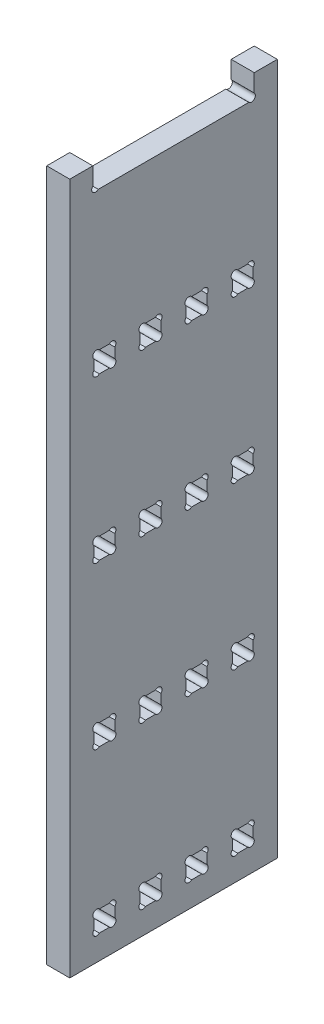
from build123d import *

# Parameters (mm, degrees)
BOSS_EXTRUDE1_DEPTH = 19.05


with BuildPart() as part:
    # Sketch8 → Boss-Extrude1 (new body)
    with BuildSketch(Plane(origin=(0, 0, 0), x_dir=(0, 0, -1), z_dir=(1, 0, 0))):
        with BuildLine():
            Line((-171.45, -571.5), (0, -571.5))
            Line((0, -571.5), (0, 0))
            Line((0, 0), (-19.05, 0))
            Line((-19.05, 0), (-19.05, -14.559871939))
            ThreePointArc((-19.05, -14.559871939), (-19.05, -19.05), (-23.540128061, -19.05))
            Line((-23.540128061, -19.05), (-147.909871939, -19.05))
            ThreePointArc((-147.909871939, -19.05), (-152.4, -19.05), (-152.4, -14.559871939))
            Line((-152.4, -14.559871939), (-152.4, 0))
            Line((-152.4, 0), (-171.45, 0))
            Line((-171.45, 0), (-171.45, -571.5))
        make_face()
        with BuildLine():
            ThreePointArc((-147.020871939, -551.561), (-149.26593597, -552.49093597), (-151.511, -551.561))
            ThreePointArc((-151.511, -551.561), (-152.44093597, -549.31593597), (-151.511, -547.070871939))
            Line((-151.511, -547.070871939), (-151.511, -538.779128061))
            ThreePointArc((-151.511, -538.779128061), (-152.44093597, -536.53406403), (-151.511, -534.289))
            ThreePointArc((-151.511, -534.289), (-149.26593597, -533.35906403), (-147.020871939, -534.289))
            Line((-147.020871939, -534.289), (-138.729128061, -534.289))
            ThreePointArc((-138.729128061, -534.289), (-136.48406403, -533.35906403), (-134.239, -534.289))
            ThreePointArc((-134.239, -534.289), (-133.30906403, -536.53406403), (-134.239, -538.779128061))
            Line((-134.239, -538.779128061), (-134.239, -547.070871939))
            ThreePointArc((-134.239, -547.070871939), (-133.30906403, -549.31593597), (-134.239, -551.561))
            ThreePointArc((-134.239, -551.561), (-136.48406403, -552.49093597), (-138.729128061, -551.561))
            Line((-138.729128061, -551.561), (-147.020871939, -551.561))
        make_face(mode=Mode.SUBTRACT)
        with BuildLine():
            ThreePointArc((-108.920871939, -551.561), (-111.16593597, -552.49093597), (-113.411, -551.561))
            ThreePointArc((-113.411, -551.561), (-114.34093597, -549.31593597), (-113.411, -547.070871939))
            Line((-113.411, -547.070871939), (-113.411, -538.779128061))
            ThreePointArc((-113.411, -538.779128061), (-114.34093597, -536.53406403), (-113.411, -534.289))
            ThreePointArc((-113.411, -534.289), (-111.16593597, -533.35906403), (-108.920871939, -534.289))
            Line((-108.920871939, -534.289), (-100.629128061, -534.289))
            ThreePointArc((-100.629128061, -534.289), (-98.38406403, -533.35906403), (-96.139, -534.289))
            ThreePointArc((-96.139, -534.289), (-95.20906403, -536.53406403), (-96.139, -538.779128061))
            Line((-96.139, -538.779128061), (-96.139, -547.070871939))
            ThreePointArc((-96.139, -547.070871939), (-95.20906403, -549.31593597), (-96.139, -551.561))
            ThreePointArc((-96.139, -551.561), (-98.38406403, -552.49093597), (-100.629128061, -551.561))
            Line((-100.629128061, -551.561), (-108.920871939, -551.561))
        make_face(mode=Mode.SUBTRACT)
        with BuildLine():
            ThreePointArc((-147.020871939, -418.211), (-149.26593597, -419.14093597), (-151.511, -418.211))
            ThreePointArc((-151.511, -418.211), (-152.44093597, -415.96593597), (-151.511, -413.720871939))
            Line((-151.511, -413.720871939), (-151.511, -405.429128061))
            ThreePointArc((-151.511, -405.429128061), (-152.44093597, -403.18406403), (-151.511, -400.939))
            ThreePointArc((-151.511, -400.939), (-149.26593597, -400.00906403), (-147.020871939, -400.939))
            Line((-147.020871939, -400.939), (-138.729128061, -400.939))
            ThreePointArc((-138.729128061, -400.939), (-136.48406403, -400.00906403), (-134.239, -400.939))
            ThreePointArc((-134.239, -400.939), (-133.30906403, -403.18406403), (-134.239, -405.429128061))
            Line((-134.239, -405.429128061), (-134.239, -413.720871939))
            ThreePointArc((-134.239, -413.720871939), (-133.30906403, -415.96593597), (-134.239, -418.211))
            ThreePointArc((-134.239, -418.211), (-136.48406403, -419.14093597), (-138.729128061, -418.211))
            Line((-138.729128061, -418.211), (-147.020871939, -418.211))
        make_face(mode=Mode.SUBTRACT)
        with BuildLine():
            ThreePointArc((-108.920871939, -418.211), (-111.16593597, -419.14093597), (-113.411, -418.211))
            ThreePointArc((-113.411, -418.211), (-114.34093597, -415.96593597), (-113.411, -413.720871939))
            Line((-113.411, -413.720871939), (-113.411, -405.429128061))
            ThreePointArc((-113.411, -405.429128061), (-114.34093597, -403.18406403), (-113.411, -400.939))
            ThreePointArc((-113.411, -400.939), (-111.16593597, -400.00906403), (-108.920871939, -400.939))
            Line((-108.920871939, -400.939), (-100.629128061, -400.939))
            ThreePointArc((-100.629128061, -400.939), (-98.38406403, -400.00906403), (-96.139, -400.939))
            ThreePointArc((-96.139, -400.939), (-95.20906403, -403.18406403), (-96.139, -405.429128061))
            Line((-96.139, -405.429128061), (-96.139, -413.720871939))
            ThreePointArc((-96.139, -413.720871939), (-95.20906403, -415.96593597), (-96.139, -418.211))
            ThreePointArc((-96.139, -418.211), (-98.38406403, -419.14093597), (-100.629128061, -418.211))
            Line((-100.629128061, -418.211), (-108.920871939, -418.211))
        make_face(mode=Mode.SUBTRACT)
        with BuildLine():
            ThreePointArc((-70.820871939, -551.561), (-73.06593597, -552.49093597), (-75.311, -551.561))
            ThreePointArc((-75.311, -551.561), (-76.24093597, -549.31593597), (-75.311, -547.070871939))
            Line((-75.311, -547.070871939), (-75.311, -538.779128061))
            ThreePointArc((-75.311, -538.779128061), (-76.24093597, -536.53406403), (-75.311, -534.289))
            ThreePointArc((-75.311, -534.289), (-73.06593597, -533.35906403), (-70.820871939, -534.289))
            Line((-70.820871939, -534.289), (-62.529128061, -534.289))
            ThreePointArc((-62.529128061, -534.289), (-60.28406403, -533.35906403), (-58.039, -534.289))
            ThreePointArc((-58.039, -534.289), (-57.10906403, -536.53406403), (-58.039, -538.779128061))
            Line((-58.039, -538.779128061), (-58.039, -547.070871939))
            ThreePointArc((-58.039, -547.070871939), (-57.10906403, -549.31593597), (-58.039, -551.561))
            ThreePointArc((-58.039, -551.561), (-60.28406403, -552.49093597), (-62.529128061, -551.561))
            Line((-62.529128061, -551.561), (-70.820871939, -551.561))
        make_face(mode=Mode.SUBTRACT)
        with BuildLine():
            ThreePointArc((-32.720871939, -551.561), (-34.96593597, -552.49093597), (-37.211, -551.561))
            ThreePointArc((-37.211, -551.561), (-38.14093597, -549.31593597), (-37.211, -547.070871939))
            Line((-37.211, -547.070871939), (-37.211, -538.779128061))
            ThreePointArc((-37.211, -538.779128061), (-38.14093597, -536.53406403), (-37.211, -534.289))
            ThreePointArc((-37.211, -534.289), (-34.96593597, -533.35906403), (-32.720871939, -534.289))
            Line((-32.720871939, -534.289), (-24.429128061, -534.289))
            ThreePointArc((-24.429128061, -534.289), (-22.18406403, -533.35906403), (-19.939, -534.289))
            ThreePointArc((-19.939, -534.289), (-19.00906403, -536.53406403), (-19.939, -538.779128061))
            Line((-19.939, -538.779128061), (-19.939, -547.070871939))
            ThreePointArc((-19.939, -547.070871939), (-19.00906403, -549.31593597), (-19.939, -551.561))
            ThreePointArc((-19.939, -551.561), (-22.18406403, -552.49093597), (-24.429128061, -551.561))
            Line((-24.429128061, -551.561), (-32.720871939, -551.561))
        make_face(mode=Mode.SUBTRACT)
        with BuildLine():
            ThreePointArc((-70.820871939, -418.211), (-73.06593597, -419.14093597), (-75.311, -418.211))
            ThreePointArc((-75.311, -418.211), (-76.24093597, -415.96593597), (-75.311, -413.720871939))
            Line((-75.311, -413.720871939), (-75.311, -405.429128061))
            ThreePointArc((-75.311, -405.429128061), (-76.24093597, -403.18406403), (-75.311, -400.939))
            ThreePointArc((-75.311, -400.939), (-73.06593597, -400.00906403), (-70.820871939, -400.939))
            Line((-70.820871939, -400.939), (-62.529128061, -400.939))
            ThreePointArc((-62.529128061, -400.939), (-60.28406403, -400.00906403), (-58.039, -400.939))
            ThreePointArc((-58.039, -400.939), (-57.10906403, -403.18406403), (-58.039, -405.429128061))
            Line((-58.039, -405.429128061), (-58.039, -413.720871939))
            ThreePointArc((-58.039, -413.720871939), (-57.10906403, -415.96593597), (-58.039, -418.211))
            ThreePointArc((-58.039, -418.211), (-60.28406403, -419.14093597), (-62.529128061, -418.211))
            Line((-62.529128061, -418.211), (-70.820871939, -418.211))
        make_face(mode=Mode.SUBTRACT)
        with BuildLine():
            ThreePointArc((-32.720871939, -418.211), (-34.96593597, -419.14093597), (-37.211, -418.211))
            ThreePointArc((-37.211, -418.211), (-38.14093597, -415.96593597), (-37.211, -413.720871939))
            Line((-37.211, -413.720871939), (-37.211, -405.429128061))
            ThreePointArc((-37.211, -405.429128061), (-38.14093597, -403.18406403), (-37.211, -400.939))
            ThreePointArc((-37.211, -400.939), (-34.96593597, -400.00906403), (-32.720871939, -400.939))
            Line((-32.720871939, -400.939), (-24.429128061, -400.939))
            ThreePointArc((-24.429128061, -400.939), (-22.18406403, -400.00906403), (-19.939, -400.939))
            ThreePointArc((-19.939, -400.939), (-19.00906403, -403.18406403), (-19.939, -405.429128061))
            Line((-19.939, -405.429128061), (-19.939, -413.720871939))
            ThreePointArc((-19.939, -413.720871939), (-19.00906403, -415.96593597), (-19.939, -418.211))
            ThreePointArc((-19.939, -418.211), (-22.18406403, -419.14093597), (-24.429128061, -418.211))
            Line((-24.429128061, -418.211), (-32.720871939, -418.211))
        make_face(mode=Mode.SUBTRACT)
        with BuildLine():
            ThreePointArc((-147.020871939, -284.861), (-149.26593597, -285.79093597), (-151.511, -284.861))
            ThreePointArc((-151.511, -284.861), (-152.44093597, -282.61593597), (-151.511, -280.370871939))
            Line((-151.511, -280.370871939), (-151.511, -272.079128061))
            ThreePointArc((-151.511, -272.079128061), (-152.44093597, -269.83406403), (-151.511, -267.589))
            ThreePointArc((-151.511, -267.589), (-149.26593597, -266.65906403), (-147.020871939, -267.589))
            Line((-147.020871939, -267.589), (-138.729128061, -267.589))
            ThreePointArc((-138.729128061, -267.589), (-136.48406403, -266.65906403), (-134.239, -267.589))
            ThreePointArc((-134.239, -267.589), (-133.30906403, -269.83406403), (-134.239, -272.079128061))
            Line((-134.239, -272.079128061), (-134.239, -280.370871939))
            ThreePointArc((-134.239, -280.370871939), (-133.30906403, -282.61593597), (-134.239, -284.861))
            ThreePointArc((-134.239, -284.861), (-136.48406403, -285.79093597), (-138.729128061, -284.861))
            Line((-138.729128061, -284.861), (-147.020871939, -284.861))
        make_face(mode=Mode.SUBTRACT)
        with BuildLine():
            ThreePointArc((-147.020871939, -151.511), (-149.26593597, -152.44093597), (-151.511, -151.511))
            ThreePointArc((-151.511, -151.511), (-152.44093597, -149.26593597), (-151.511, -147.020871939))
            Line((-151.511, -147.020871939), (-151.511, -138.729128061))
            ThreePointArc((-151.511, -138.729128061), (-152.44093597, -136.48406403), (-151.511, -134.239))
            ThreePointArc((-151.511, -134.239), (-149.26593597, -133.30906403), (-147.020871939, -134.239))
            Line((-147.020871939, -134.239), (-138.729128061, -134.239))
            ThreePointArc((-138.729128061, -134.239), (-136.48406403, -133.30906403), (-134.239, -134.239))
            ThreePointArc((-134.239, -134.239), (-133.30906403, -136.48406403), (-134.239, -138.729128061))
            Line((-134.239, -138.729128061), (-134.239, -147.020871939))
            ThreePointArc((-134.239, -147.020871939), (-133.30906403, -149.26593597), (-134.239, -151.511))
            ThreePointArc((-134.239, -151.511), (-136.48406403, -152.44093597), (-138.729128061, -151.511))
            Line((-138.729128061, -151.511), (-147.020871939, -151.511))
        make_face(mode=Mode.SUBTRACT)
        with BuildLine():
            ThreePointArc((-108.920871939, -284.861), (-111.16593597, -285.79093597), (-113.411, -284.861))
            ThreePointArc((-113.411, -284.861), (-114.34093597, -282.61593597), (-113.411, -280.370871939))
            Line((-113.411, -280.370871939), (-113.411, -272.079128061))
            ThreePointArc((-113.411, -272.079128061), (-114.34093597, -269.83406403), (-113.411, -267.589))
            ThreePointArc((-113.411, -267.589), (-111.16593597, -266.65906403), (-108.920871939, -267.589))
            Line((-108.920871939, -267.589), (-100.629128061, -267.589))
            ThreePointArc((-100.629128061, -267.589), (-98.38406403, -266.65906403), (-96.139, -267.589))
            ThreePointArc((-96.139, -267.589), (-95.20906403, -269.83406403), (-96.139, -272.079128061))
            Line((-96.139, -272.079128061), (-96.139, -280.370871939))
            ThreePointArc((-96.139, -280.370871939), (-95.20906403, -282.61593597), (-96.139, -284.861))
            ThreePointArc((-96.139, -284.861), (-98.38406403, -285.79093597), (-100.629128061, -284.861))
            Line((-100.629128061, -284.861), (-108.920871939, -284.861))
        make_face(mode=Mode.SUBTRACT)
        with BuildLine():
            ThreePointArc((-108.920871939, -151.511), (-111.16593597, -152.44093597), (-113.411, -151.511))
            ThreePointArc((-113.411, -151.511), (-114.34093597, -149.26593597), (-113.411, -147.020871939))
            Line((-113.411, -147.020871939), (-113.411, -138.729128061))
            ThreePointArc((-113.411, -138.729128061), (-114.34093597, -136.48406403), (-113.411, -134.239))
            ThreePointArc((-113.411, -134.239), (-111.16593597, -133.30906403), (-108.920871939, -134.239))
            Line((-108.920871939, -134.239), (-100.629128061, -134.239))
            ThreePointArc((-100.629128061, -134.239), (-98.38406403, -133.30906403), (-96.139, -134.239))
            ThreePointArc((-96.139, -134.239), (-95.20906403, -136.48406403), (-96.139, -138.729128061))
            Line((-96.139, -138.729128061), (-96.139, -147.020871939))
            ThreePointArc((-96.139, -147.020871939), (-95.20906403, -149.26593597), (-96.139, -151.511))
            ThreePointArc((-96.139, -151.511), (-98.38406403, -152.44093597), (-100.629128061, -151.511))
            Line((-100.629128061, -151.511), (-108.920871939, -151.511))
        make_face(mode=Mode.SUBTRACT)
        with BuildLine():
            ThreePointArc((-70.820871939, -284.861), (-73.06593597, -285.79093597), (-75.311, -284.861))
            ThreePointArc((-75.311, -284.861), (-76.24093597, -282.61593597), (-75.311, -280.370871939))
            Line((-75.311, -280.370871939), (-75.311, -272.079128061))
            ThreePointArc((-75.311, -272.079128061), (-76.24093597, -269.83406403), (-75.311, -267.589))
            ThreePointArc((-75.311, -267.589), (-73.06593597, -266.65906403), (-70.820871939, -267.589))
            Line((-70.820871939, -267.589), (-62.529128061, -267.589))
            ThreePointArc((-62.529128061, -267.589), (-60.28406403, -266.65906403), (-58.039, -267.589))
            ThreePointArc((-58.039, -267.589), (-57.10906403, -269.83406403), (-58.039, -272.079128061))
            Line((-58.039, -272.079128061), (-58.039, -280.370871939))
            ThreePointArc((-58.039, -280.370871939), (-57.10906403, -282.61593597), (-58.039, -284.861))
            ThreePointArc((-58.039, -284.861), (-60.28406403, -285.79093597), (-62.529128061, -284.861))
            Line((-62.529128061, -284.861), (-70.820871939, -284.861))
        make_face(mode=Mode.SUBTRACT)
        with BuildLine():
            ThreePointArc((-70.820871939, -151.511), (-73.06593597, -152.44093597), (-75.311, -151.511))
            ThreePointArc((-75.311, -151.511), (-76.24093597, -149.26593597), (-75.311, -147.020871939))
            Line((-75.311, -147.020871939), (-75.311, -138.729128061))
            ThreePointArc((-75.311, -138.729128061), (-76.24093597, -136.48406403), (-75.311, -134.239))
            ThreePointArc((-75.311, -134.239), (-73.06593597, -133.30906403), (-70.820871939, -134.239))
            Line((-70.820871939, -134.239), (-62.529128061, -134.239))
            ThreePointArc((-62.529128061, -134.239), (-60.28406403, -133.30906403), (-58.039, -134.239))
            ThreePointArc((-58.039, -134.239), (-57.10906403, -136.48406403), (-58.039, -138.729128061))
            Line((-58.039, -138.729128061), (-58.039, -147.020871939))
            ThreePointArc((-58.039, -147.020871939), (-57.10906403, -149.26593597), (-58.039, -151.511))
            ThreePointArc((-58.039, -151.511), (-60.28406403, -152.44093597), (-62.529128061, -151.511))
            Line((-62.529128061, -151.511), (-70.820871939, -151.511))
        make_face(mode=Mode.SUBTRACT)
        with BuildLine():
            ThreePointArc((-32.720871939, -284.861), (-34.96593597, -285.79093597), (-37.211, -284.861))
            ThreePointArc((-37.211, -284.861), (-38.14093597, -282.61593597), (-37.211, -280.370871939))
            Line((-37.211, -280.370871939), (-37.211, -272.079128061))
            ThreePointArc((-37.211, -272.079128061), (-38.14093597, -269.83406403), (-37.211, -267.589))
            ThreePointArc((-37.211, -267.589), (-34.96593597, -266.65906403), (-32.720871939, -267.589))
            Line((-32.720871939, -267.589), (-24.429128061, -267.589))
            ThreePointArc((-24.429128061, -267.589), (-22.18406403, -266.65906403), (-19.939, -267.589))
            ThreePointArc((-19.939, -267.589), (-19.00906403, -269.83406403), (-19.939, -272.079128061))
            Line((-19.939, -272.079128061), (-19.939, -280.370871939))
            ThreePointArc((-19.939, -280.370871939), (-19.00906403, -282.61593597), (-19.939, -284.861))
            ThreePointArc((-19.939, -284.861), (-22.18406403, -285.79093597), (-24.429128061, -284.861))
            Line((-24.429128061, -284.861), (-32.720871939, -284.861))
        make_face(mode=Mode.SUBTRACT)
        with BuildLine():
            ThreePointArc((-32.720871939, -151.511), (-34.96593597, -152.44093597), (-37.211, -151.511))
            ThreePointArc((-37.211, -151.511), (-38.14093597, -149.26593597), (-37.211, -147.020871939))
            Line((-37.211, -147.020871939), (-37.211, -138.729128061))
            ThreePointArc((-37.211, -138.729128061), (-38.14093597, -136.48406403), (-37.211, -134.239))
            ThreePointArc((-37.211, -134.239), (-34.96593597, -133.30906403), (-32.720871939, -134.239))
            Line((-32.720871939, -134.239), (-24.429128061, -134.239))
            ThreePointArc((-24.429128061, -134.239), (-22.18406403, -133.30906403), (-19.939, -134.239))
            ThreePointArc((-19.939, -134.239), (-19.00906403, -136.48406403), (-19.939, -138.729128061))
            Line((-19.939, -138.729128061), (-19.939, -147.020871939))
            ThreePointArc((-19.939, -147.020871939), (-19.00906403, -149.26593597), (-19.939, -151.511))
            ThreePointArc((-19.939, -151.511), (-22.18406403, -152.44093597), (-24.429128061, -151.511))
            Line((-24.429128061, -151.511), (-32.720871939, -151.511))
        make_face(mode=Mode.SUBTRACT)
    extrude(amount=BOSS_EXTRUDE1_DEPTH)


solid = part.part
